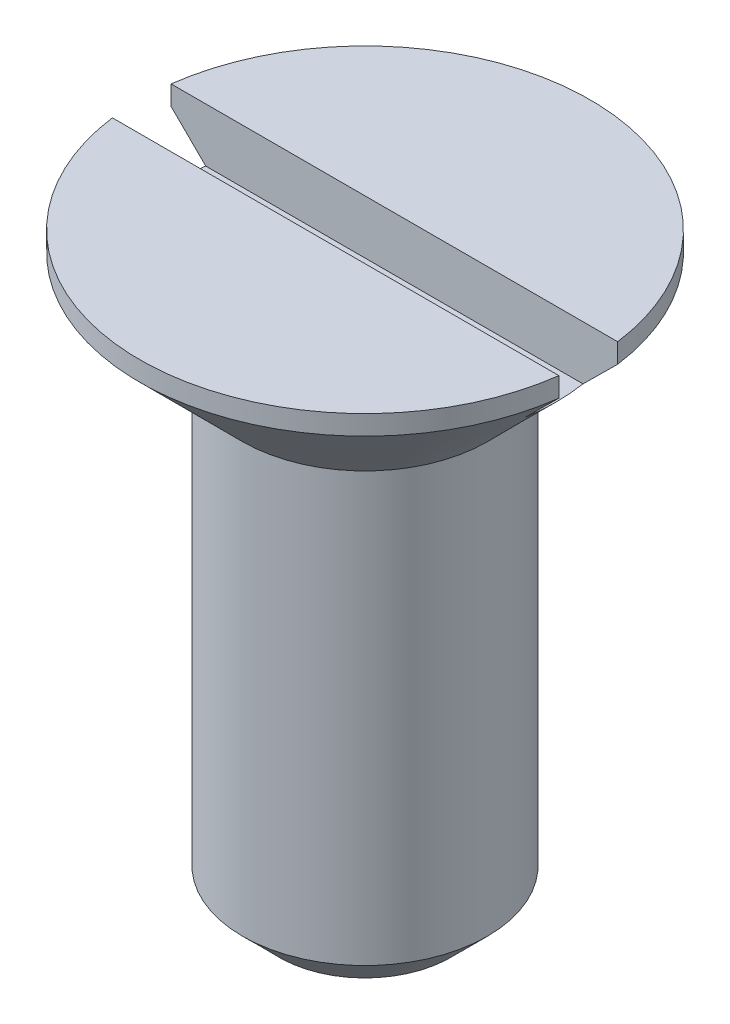
from build123d import *

# Parameters (mm, degrees)
SKETCH_13_W         = 9.2
SKETCH_13_H         = 1.2
CUT_EXTRUDE_9_DEPTH = 1.1
CHAMFER_1_SIZE      = 0.75


with BuildPart() as part:
    # Эскиз1 → Повернуть1 (revolve)
    with BuildSketch(Plane.XY):
        Polygon((0, 92.035042223), (0, 80.035042223), (2.5, 80.035042223), (2.5, 89.535042223), (4.6, 91.635042223), (4.6, 92.035042223), align=None)
    revolve(axis=Axis((0, 125.763182898, 0), (0, -1, 0)))

    # Эскиз13 → Вырез-Вытянуть9 (cut)
    with BuildSketch(Plane(origin=(0, 92.035042223, 0), x_dir=(-1, 0, 0), z_dir=(0, 1, 0))):
        Rectangle(SKETCH_13_W, SKETCH_13_H)
    extrude(amount=-CUT_EXTRUDE_9_DEPTH, mode=Mode.SUBTRACT)

    # Фаска1
    chamfer_1_edges = [part.edges().sort_by_distance(p)[0] for p in [
        (-2.5, 80.035042223, 0),
    ]]
    chamfer(chamfer_1_edges, length=CHAMFER_1_SIZE)


solid = part.part
